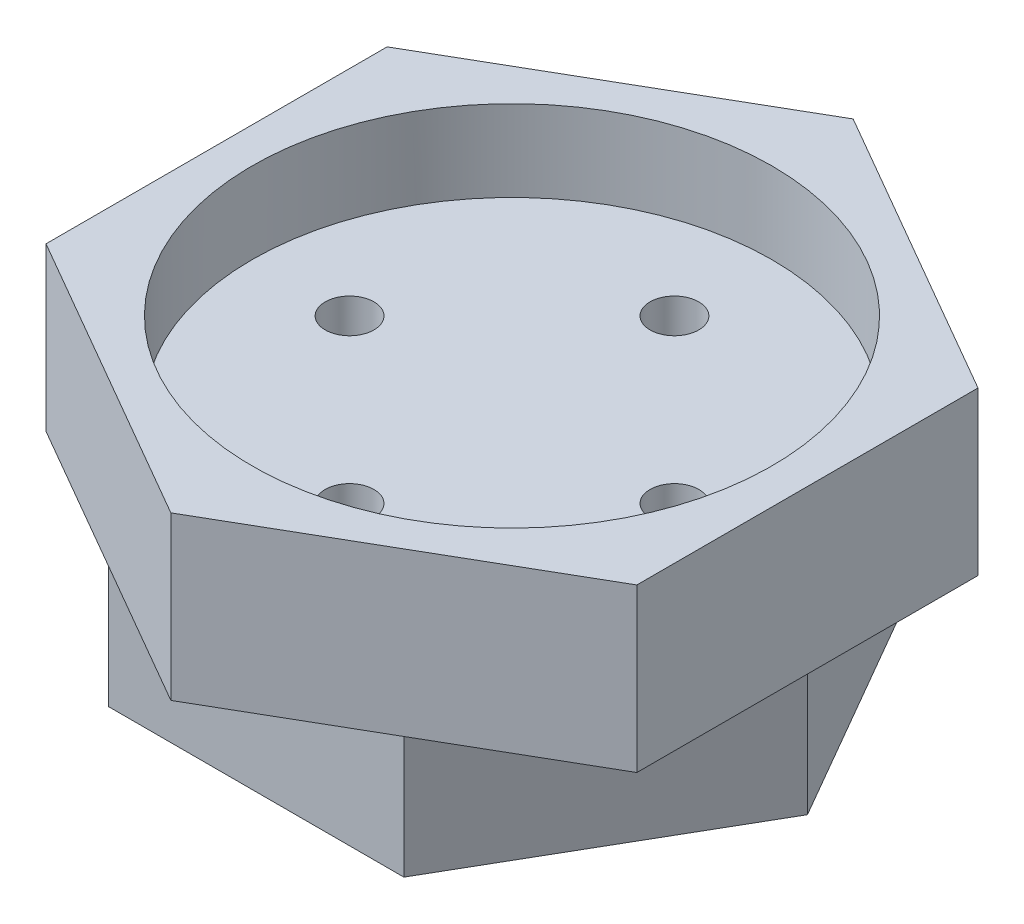
from build123d import *

# Parameters (mm, degrees)
SKETCH2_R           = 32
BOSS_EXTRUDE1_DEPTH = 10
SKETCH3_R           = 42
SKETCH3_R_2         = 32
EXTRUDE_THIN1_DEPTH = 20
SKETCH4_OUTSIDE_W   = 110.094
SKETCH4_OUTSIDE_H   = 110.094
CUT_EXTRUDE1_DEPTH  = 63.673758464
BOSS_EXTRUDE2_DEPTH = 15
SKETCH6_R           = 3
CUT_EXTRUDE2_DEPTH  = 66.665820638


with BuildPart() as part:
    # Sketch2 → Boss-Extrude1 (new body)
    with BuildSketch(Plane(origin=(0, 0, 0), x_dir=(1, 0, 0), z_dir=(0, 1, 0))):
        with Locations(Location((0, 0, 0), (0, 0, 270))):
            Circle(SKETCH2_R)
    extrude(amount=BOSS_EXTRUDE1_DEPTH)

    # Sketch3 → Extrude-Thin1 (add)
    with BuildSketch(Plane.XZ):
        Circle(SKETCH3_R)
        Circle(SKETCH3_R_2, mode=Mode.SUBTRACT)
    extrude(amount=-EXTRUDE_THIN1_DEPTH)

    # Sketch4 outside → Cut-Extrude1 (cut, through all)
    with BuildSketch(Plane.XZ):
        Rectangle(SKETCH4_OUTSIDE_W, SKETCH4_OUTSIDE_H)
        Polygon((36.373066959, -21), (36.373066959, 21), (0, 42), (-36.373066959, 21), (-36.373066959, -21), (0, -42), align=None, mode=Mode.SUBTRACT)
    extrude(amount=-CUT_EXTRUDE1_DEPTH, mode=Mode.SUBTRACT)

    # Sketch5 → Boss-Extrude2 (add)
    with BuildSketch(Plane.XZ):
        Polygon((36.373066959, 0), (18.186533479, 31.5), (-18.186533479, 31.5), (-36.373066959, 0), (-18.186533479, -31.5), (18.186533479, -31.5), align=None)
    extrude(amount=BOSS_EXTRUDE2_DEPTH)

    # Sketch6 → Cut-Extrude2 (cut, through all)
    with BuildSketch(Plane.XZ.offset(15)):
        with Locations(Location((0, 20, 0), (0, 0, 270))):
            Circle(SKETCH6_R)
        with Locations(Location((20, 0, 0), (0, 0, 270))):
            Circle(SKETCH6_R)
        with Locations(Location((0, -20, 0), (0, 0, 270))):
            Circle(SKETCH6_R)
        with Locations(Location((-20, 0, 0), (0, 0, 270))):
            Circle(SKETCH6_R)
    extrude(amount=-CUT_EXTRUDE2_DEPTH, mode=Mode.SUBTRACT)


solid = part.part
